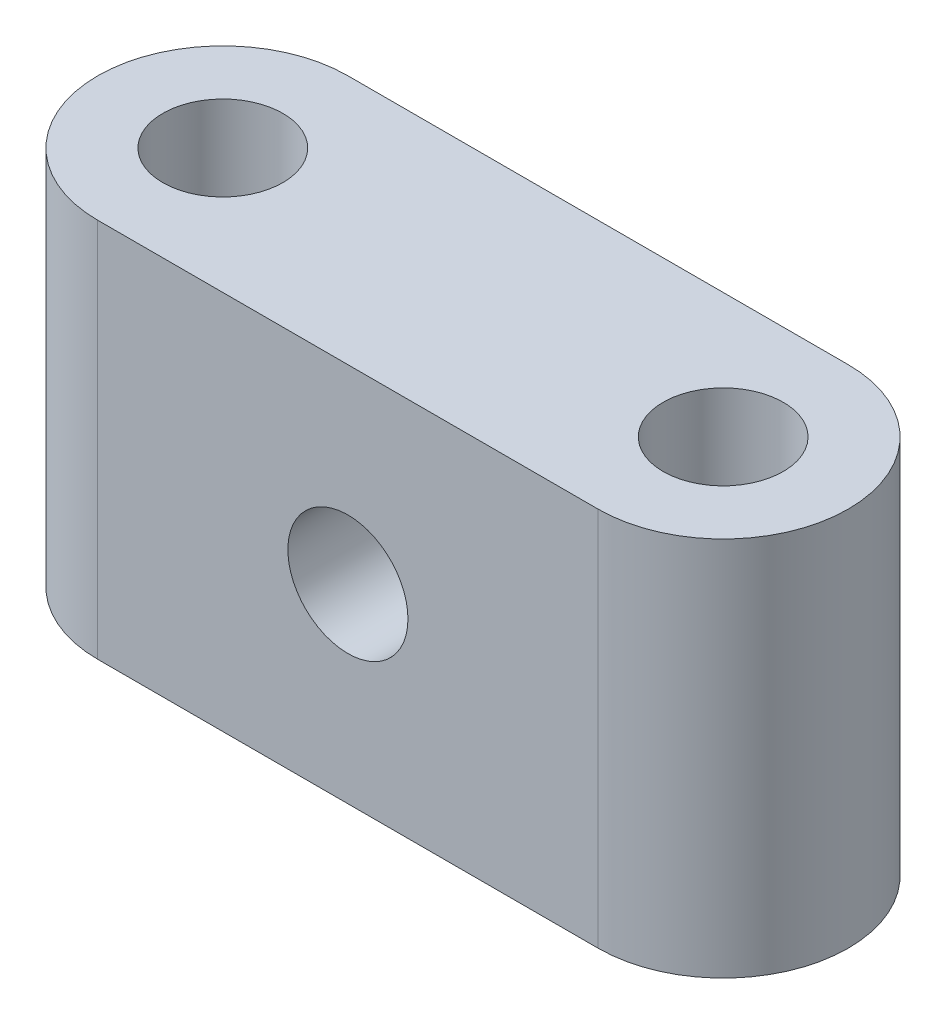
from build123d import *

# Parameters (mm, degrees)
SZKIC1_R                    = 6
DODANIE_WYCI_GNI_CIE1_DEPTH = 38
SZKIC2_R                    = 6
WYTNIJ_WYCI_GNI_CIE1_DEPTH  = 12.5


with BuildPart() as part:
    # Szkic1 → Dodanie-wyciągnięcie1 (new body)
    with BuildSketch(Plane(origin=(0, 0, 0), x_dir=(1, 0, 0), z_dir=(0, 1, 0))):
        with BuildLine():
            Line((0, 12.5), (50, 12.5))
            ThreePointArc((50, 12.5), (62.5, 0), (50, -12.5))
            Line((50, -12.5), (0, -12.5))
            ThreePointArc((0, -12.5), (-12.5, 0), (0, 12.5))
        make_face()
        with Locations(Location((0, 0, 0), (0, 0, 270))):
            Circle(SZKIC1_R, mode=Mode.SUBTRACT)
        with Locations(Location((50, 0, 0), (0, 0, 270))):
            Circle(SZKIC1_R, mode=Mode.SUBTRACT)
    extrude(amount=DODANIE_WYCI_GNI_CIE1_DEPTH)

    # Szkic2 → Wytnij-wyciągnięcie1 (cut)
    with BuildSketch(Plane.XY.offset(12.5)):
        with Locations((25, 19)):
            Circle(SZKIC2_R)
    extrude(amount=-WYTNIJ_WYCI_GNI_CIE1_DEPTH, mode=Mode.SUBTRACT)


solid = part.part
